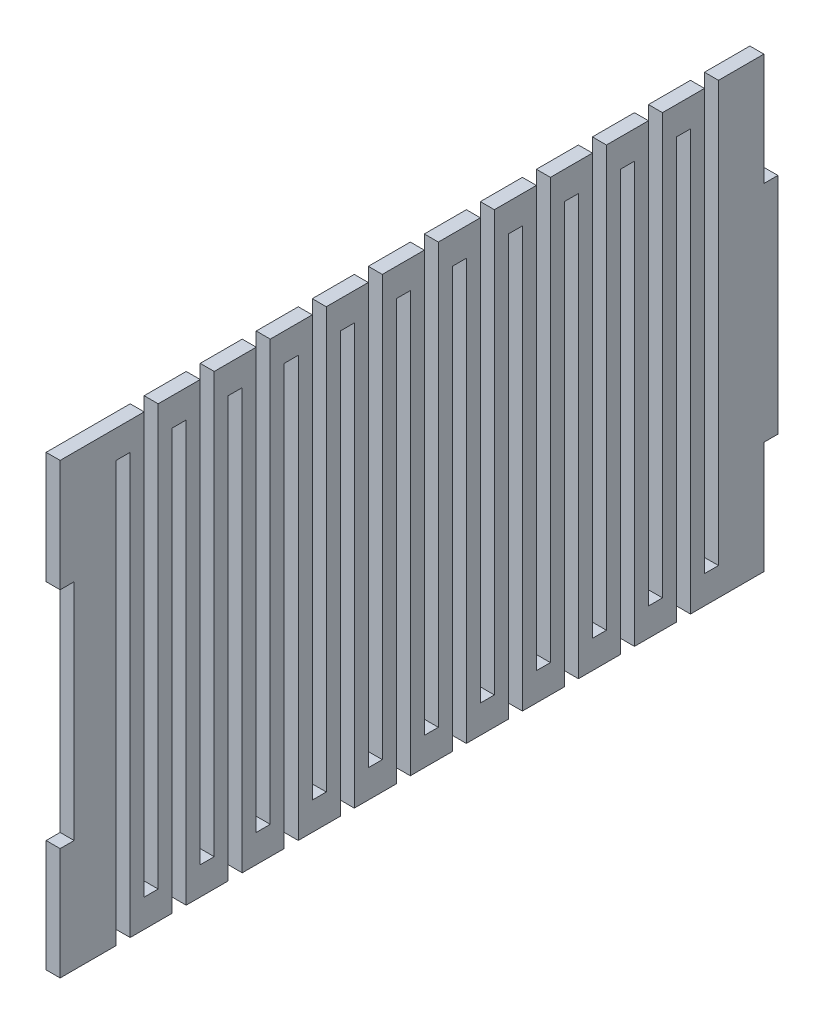
from build123d import *

# Parameters (mm, degrees)
BOSS_EXTRUDE2_DEPTH = 3.175


with BuildPart() as part:
    # Sketch2 → Boss-Extrude2 (new body)
    with BuildSketch(Plane(origin=(0, 0, 0), x_dir=(0, 0, -1), z_dir=(1, 0, 0))):
        Polygon((0, 101.6), (0, 76.2), (3.175, 76.2), (3.175, 25.4), (0, 25.4), (0, 0), (12.7, 0), (12.7, 95.25), (15.875, 95.25), (15.875, 0), (25.4, 0), (25.4, 95.25), (28.575, 95.25), (28.575, 0), (38.1, 0), (38.1, 95.25), (41.275, 95.25), (41.275, 0), (50.8, 0), (50.8, 95.25), (53.975, 95.25), (53.975, 0), (63.5, 0), (63.5, 95.25), (66.675, 95.25), (66.675, 0), (76.2, 0), (76.2, 95.25), (79.375, 95.25), (79.375, 0), (88.9, 0), (88.9, 95.25), (92.075, 95.25), (92.075, 0), (101.6, 0), (101.6, 95.25), (104.775, 95.25), (104.775, 0), (114.3, 0), (114.3, 95.25), (117.475, 95.25), (117.475, 0), (127, 0), (127, 95.25), (130.175, 95.25), (130.175, 0), (139.7, 0), (139.7, 95.25), (142.875, 95.25), (142.875, 0), (159.512, 0), (159.512, 25.4), (162.687, 25.4), (162.687, 76.2), (159.512, 76.2), (159.512, 101.6), (149.225, 101.6), (149.225, 6.35), (146.05, 6.35), (146.05, 101.6), (136.525, 101.6), (136.525, 6.35), (133.35, 6.35), (133.35, 101.6), (123.825, 101.6), (123.825, 6.35), (120.65, 6.35), (120.65, 101.6), (111.125, 101.6), (111.125, 6.35), (107.95, 6.35), (107.95, 101.6), (98.425, 101.6), (98.425, 6.35), (95.25, 6.35), (95.25, 101.6), (85.725, 101.6), (85.725, 6.35), (82.55, 6.35), (82.55, 101.6), (73.025, 101.6), (73.025, 6.35), (69.85, 6.35), (69.85, 101.6), (60.325, 101.6), (60.325, 6.35), (57.15, 6.35), (57.15, 101.6), (47.625, 101.6), (47.625, 6.35), (44.45, 6.35), (44.45, 101.6), (34.925, 101.6), (34.925, 6.35), (31.75, 6.35), (31.75, 101.6), (25.358279829, 101.6), (22.225, 101.6), (22.225, 6.35), (19.05, 6.35), (19.05, 101.6), align=None)
    extrude(amount=BOSS_EXTRUDE2_DEPTH)


solid = part.part
